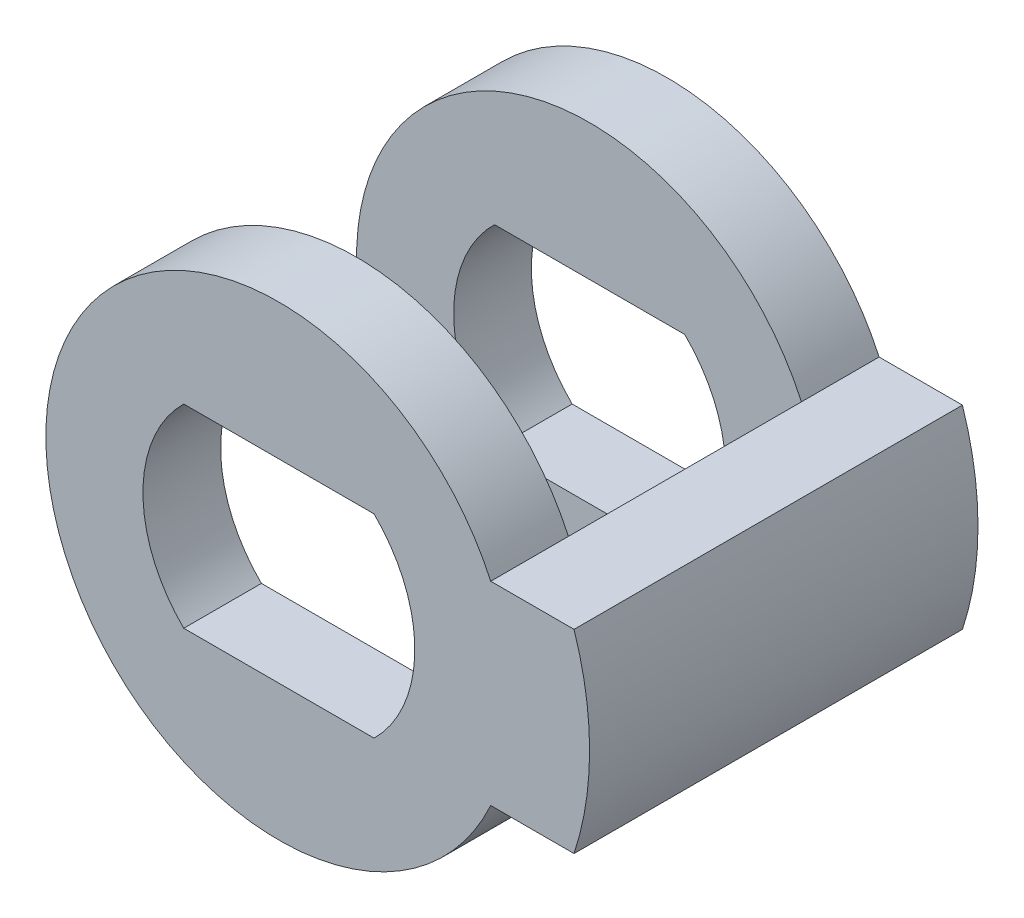
from build123d import *

# Parameters (mm, degrees)
BOSS_EXTRUDE2_DEPTH      = 10
BOSS_EXTRUDE2_DEPTH_BACK = 10
CUT_EXTRUDE1_DEPTH       = 6
CUT_EXTRUDE1_DEPTH_BACK  = 6
SKETCH3_R                = 12


with BuildPart() as part:
    # Sketch1 → Boss-Extrude2 (new, two sides: drawn at the far end of the back side and taken through both)
    with BuildSketch(Plane.XY.offset(-BOSS_EXTRUDE2_DEPTH_BACK)):
        with BuildLine():
            ThreePointArc((10.908712115, 5), (-12, 0), (10.908712115, -5))
            Line((10.908712115, -5), (15.198684154, -5))
            ThreePointArc((15.198684154, -5), (16, 0), (15.198684154, 5))
            Line((15.198684154, 5), (10.908712115, 5))
        make_face()
        with BuildLine():
            Line((-4.898979486, 5), (4.898979486, 5))
            ThreePointArc((4.898979486, 5), (7, 0), (4.898979486, -5))
            Line((4.898979486, -5), (-4.898979486, -5))
            ThreePointArc((-4.898979486, -5), (-7, 0), (-4.898979486, 5))
        make_face(mode=Mode.SUBTRACT)
    extrude(amount=BOSS_EXTRUDE2_DEPTH + BOSS_EXTRUDE2_DEPTH_BACK)

    # Sketch3 → Cut-Extrude1 (cut, two sides: drawn at the far end of the back side and taken through both)
    with BuildSketch(Plane.XY.offset(-CUT_EXTRUDE1_DEPTH_BACK)):
        Circle(SKETCH3_R)
    extrude(amount=CUT_EXTRUDE1_DEPTH + CUT_EXTRUDE1_DEPTH_BACK, mode=Mode.SUBTRACT)


solid = part.part
